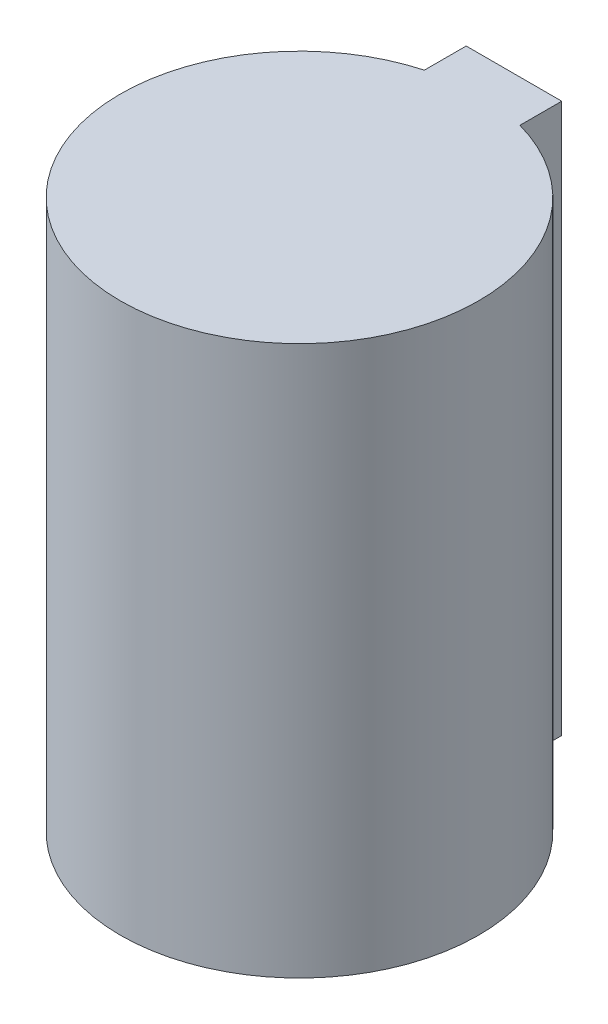
from build123d import *

# Parameters (mm, degrees)
RESSALTO_EXTRUS_O1_DEPTH = 23


with BuildPart() as part:
    # Esboço1 → Ressalto-extrusão1 (new body)
    with BuildSketch(Plane(origin=(0, 0, 0), x_dir=(1, 0, 0), z_dir=(0, 1, 0))):
        with BuildLine():
            Line((-2, 8.978416147), (2, 8.978416147))
            Line((2, 8.978416147), (2, 7.228416147))
            ThreePointArc((2, 7.228416147), (0, -7.5), (-2, 7.228416147))
            Line((-2, 7.228416147), (-2, 8.978416147))
        make_face()
    extrude(amount=RESSALTO_EXTRUS_O1_DEPTH)


solid = part.part
